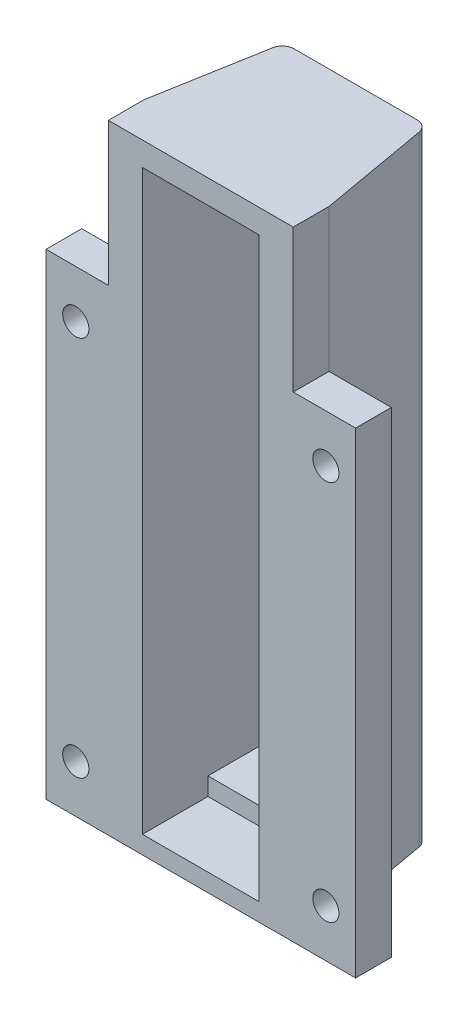
from build123d import *

# Parameters (mm, degrees)
EXTRUDE_1_DEPTH     = 40
EXTRUDE_2_DEPTH     = 12
SKETCH_3_W          = 9.8
SKETCH_3_H          = 45.5
CUT_EXTRUDE_1_DEPTH = 10
SKETCH_4_W          = 9.8
SKETCH_4_H          = 48.5
CUT_EXTRUDE_2_DEPTH = 5.5
SKETCH_5_R          = 1.1
CUT_EXTRUDE_3_DEPTH = 56.154328933
SKETCH_6_W          = 3.5
SKETCH_6_H          = 35
CUT_EXTRUDE_4_DEPTH = 55.525223521
SKETCH_7_R          = 1.1
CUT_EXTRUDE_5_DEPTH = 55.525223521
SKETCH_8_R          = 1.95
CUT_EXTRUDE_6_DEPTH = 1.2
FILLET_2_R          = 1


with BuildPart() as part:
    # 草图1 → 凸台-拉伸1 (new body)
    with BuildSketch(Plane(origin=(0, 0, 0), x_dir=(1, 0, 0), z_dir=(0, 1, 0))):
        Polygon((-6, 11.5), (-7.763269807, 1.5), (7.763269807, 1.5), (6, 11.5), align=None)
        Polygon((-7.763269807, 1.5), (-8.292250749, -1.5), (8.292250749, -1.5), (7.763269807, 1.5), align=None)
        Polygon((-13, 1.5), (-13, -1.5), (-8.292250749, -1.5), (-7.763269807, 1.5), align=None)
        Polygon((7.763269807, 1.5), (8.292250749, -1.5), (13, -1.5), (13, 1.5), align=None)
    extrude(amount=EXTRUDE_1_DEPTH)

    # 草图2 → 凸台-拉伸2 (add)
    with BuildSketch(Plane(origin=(0, 40, 0), x_dir=(1, 0, 0), z_dir=(0, 1, 0))):
        Polygon((6, 11.5), (7.763269807, 1.5), (7.763269807, -1.5), (-7.763269807, -1.5), (-7.763269807, 1.5), (-6, 11.5), align=None)
    extrude(amount=EXTRUDE_2_DEPTH)

    # 草图3 → 切除-拉伸1 (cut)
    with BuildSketch(Plane.XY.offset(1.5)):
        with Locations((0, 25.75)):
            Rectangle(SKETCH_3_W, SKETCH_3_H)
    extrude(amount=-CUT_EXTRUDE_1_DEPTH, mode=Mode.SUBTRACT)

    # 草图4 → 切除-拉伸2 (cut)
    with BuildSketch(Plane.XY.offset(1.5)):
        with Locations((0, 25.75)):
            Rectangle(SKETCH_4_W, SKETCH_4_H)
    extrude(amount=-CUT_EXTRUDE_2_DEPTH, mode=Mode.SUBTRACT)

    # 草图5 → 切除-拉伸3 (cut, through all)
    with BuildSketch(Plane.XY.offset(1.5)):
        with Locations((-10.5, 36)):
            Circle(SKETCH_5_R)
        with Locations(Location((-10.5, 4, 0), (0, 0, 180))):
            Circle(SKETCH_5_R)
        with Locations((10.5, 4)):
            Circle(SKETCH_5_R)
        with Locations(Location((10.5, 36, 0), (0, 0, 180))):
            Circle(SKETCH_5_R)
    extrude(amount=-CUT_EXTRUDE_3_DEPTH, mode=Mode.SUBTRACT)

    # 草图6 → 切除-拉伸4 (cut, through all)
    with BuildSketch(Plane.XY.offset(-8.5)):
        with Locations((0, 25.75)):
            Rectangle(SKETCH_6_W, SKETCH_6_H)
    extrude(amount=-CUT_EXTRUDE_4_DEPTH, mode=Mode.SUBTRACT)

    # 草图7 → 切除-拉伸5 (cut, through all)
    with BuildSketch(Plane.XY.offset(-8.5)):
        with Locations((0, 46.25)):
            Circle(SKETCH_7_R)
        with Locations(Location((0, 5.25, 0), (0, 0, 180))):
            Circle(SKETCH_7_R)
    extrude(amount=-CUT_EXTRUDE_5_DEPTH, mode=Mode.SUBTRACT)

    # 草图8 → 切除-拉伸6 (cut)
    with BuildSketch(Plane(origin=(0, 0, -11.5), x_dir=(-1, 0, 0), z_dir=(0, 0, -1))):
        with Locations((0, 46.25)):
            Circle(SKETCH_8_R)
        with Locations((0, 5.25)):
            Circle(SKETCH_8_R)
    extrude(amount=-CUT_EXTRUDE_6_DEPTH, mode=Mode.SUBTRACT)

    # 圆角2
    fillet_2_edges = [part.edges().sort_by_distance(p)[0] for p in [
        (6, 26, -11.5),
        (-6, 26, -11.5),
    ]]
    fillet(fillet_2_edges, radius=FILLET_2_R)


solid = part.part
